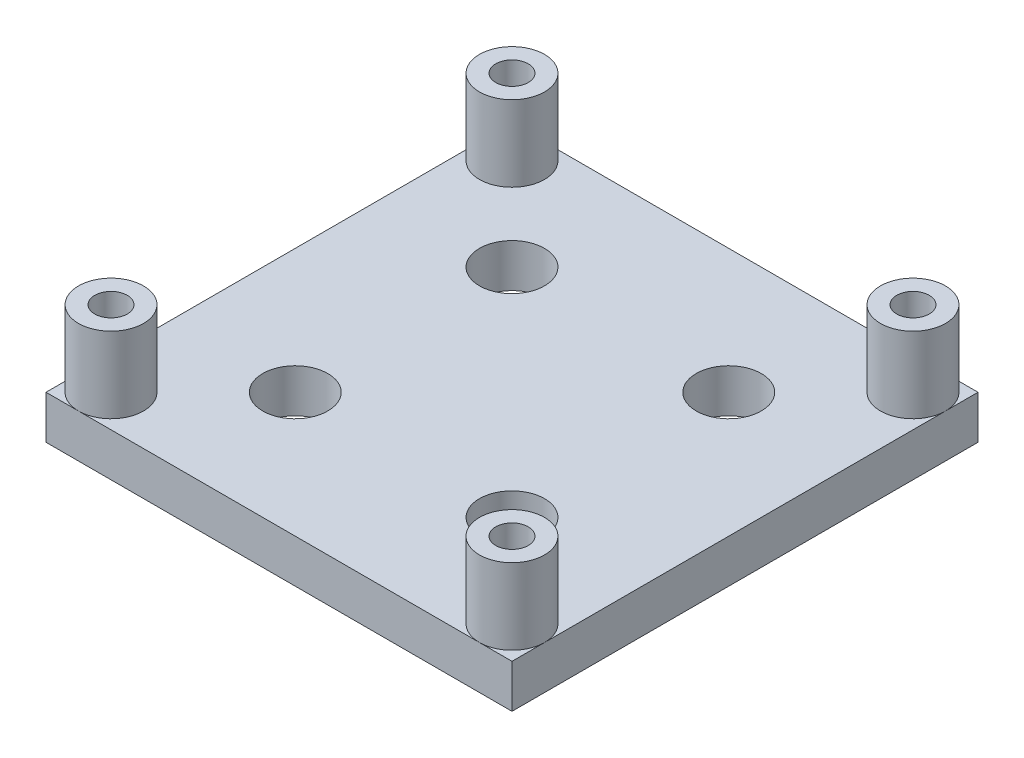
from build123d import *

# Parameters (mm, degrees)
SKETCH_1_W      = 43
SKETCH_1_H      = 43
SKETCH_1_R      = 3
SKETCH_1_R_2    = 1.5
EXTRUDE_1_DEPTH = 4
SKETCH_2_R      = 3
SKETCH_2_R_2    = 1.5
EXTRUDE_2_DEPTH = 7


with BuildPart() as part:
    # 草图1 → 凸台-拉伸1 (new body)
    with BuildSketch(Plane(origin=(0, 0, 0), x_dir=(1, 0, 0), z_dir=(0, 1, 0))):
        Rectangle(SKETCH_1_W, SKETCH_1_H)
        with Locations(Location((-10, 10, 0), (0, 0, 270))):
            Circle(SKETCH_1_R, mode=Mode.SUBTRACT)
        with Locations(Location((10, 10, 0), (0, 0, 270))):
            Circle(SKETCH_1_R, mode=Mode.SUBTRACT)
        with Locations(Location((-10, -10, 0), (0, 0, 270))):
            Circle(SKETCH_1_R, mode=Mode.SUBTRACT)
        with Locations(Location((10, -10, 0), (0, 0, 270))):
            Circle(SKETCH_1_R, mode=Mode.SUBTRACT)
        with Locations(Location((-18.5, 18.5, 0), (0, 0, 270))):
            Circle(SKETCH_1_R_2, mode=Mode.SUBTRACT)
        with Locations(Location((18.5, 18.5, 0), (0, 0, 270))):
            Circle(SKETCH_1_R_2, mode=Mode.SUBTRACT)
        with Locations(Location((18.5, -18.5, 0), (0, 0, 270))):
            Circle(SKETCH_1_R_2, mode=Mode.SUBTRACT)
        with Locations(Location((-18.5, -18.5, 0), (0, 0, 270))):
            Circle(SKETCH_1_R_2, mode=Mode.SUBTRACT)
    extrude(amount=EXTRUDE_1_DEPTH)

    # 草图2 → 凸台-拉伸2 (add)
    # profile 1 of 4: a face of its own
    with BuildSketch(Plane(origin=(0, 4, 0), x_dir=(1, 0, 0), z_dir=(0, 1, 0))):
        with Locations(Location((-18.5, -18.5, 0), (0, 0, 270))):
            Circle(SKETCH_2_R)
        with Locations(Location((-18.5, -18.5, 0), (0, 0, 270))):
            Circle(SKETCH_2_R_2, mode=Mode.SUBTRACT)
    # profile 2 of 4: a face of its own
    with BuildSketch(Plane(origin=(0, 4, 0), x_dir=(1, 0, 0), z_dir=(0, 1, 0))):
        with Locations(Location((18.5, -18.5, 0), (0, 0, 270))):
            Circle(SKETCH_2_R)
        with Locations(Location((18.5, -18.5, 0), (0, 0, 270))):
            Circle(SKETCH_2_R_2, mode=Mode.SUBTRACT)
    # profile 3 of 4: a face of its own
    with BuildSketch(Plane(origin=(0, 4, 0), x_dir=(1, 0, 0), z_dir=(0, 1, 0))):
        with Locations(Location((18.5, 18.5, 0), (0, 0, 90))):
            Circle(SKETCH_2_R)
        with Locations(Location((18.5, 18.5, 0), (0, 0, 270))):
            Circle(SKETCH_2_R_2, mode=Mode.SUBTRACT)
    # profile 4 of 4: a face of its own
    with BuildSketch(Plane(origin=(0, 4, 0), x_dir=(1, 0, 0), z_dir=(0, 1, 0))):
        with Locations(Location((-18.5, 18.5, 0), (0, 0, 90))):
            Circle(SKETCH_2_R)
        with Locations(Location((-18.5, 18.5, 0), (0, 0, 270))):
            Circle(SKETCH_2_R_2, mode=Mode.SUBTRACT)
    extrude(amount=EXTRUDE_2_DEPTH)


solid = part.part
